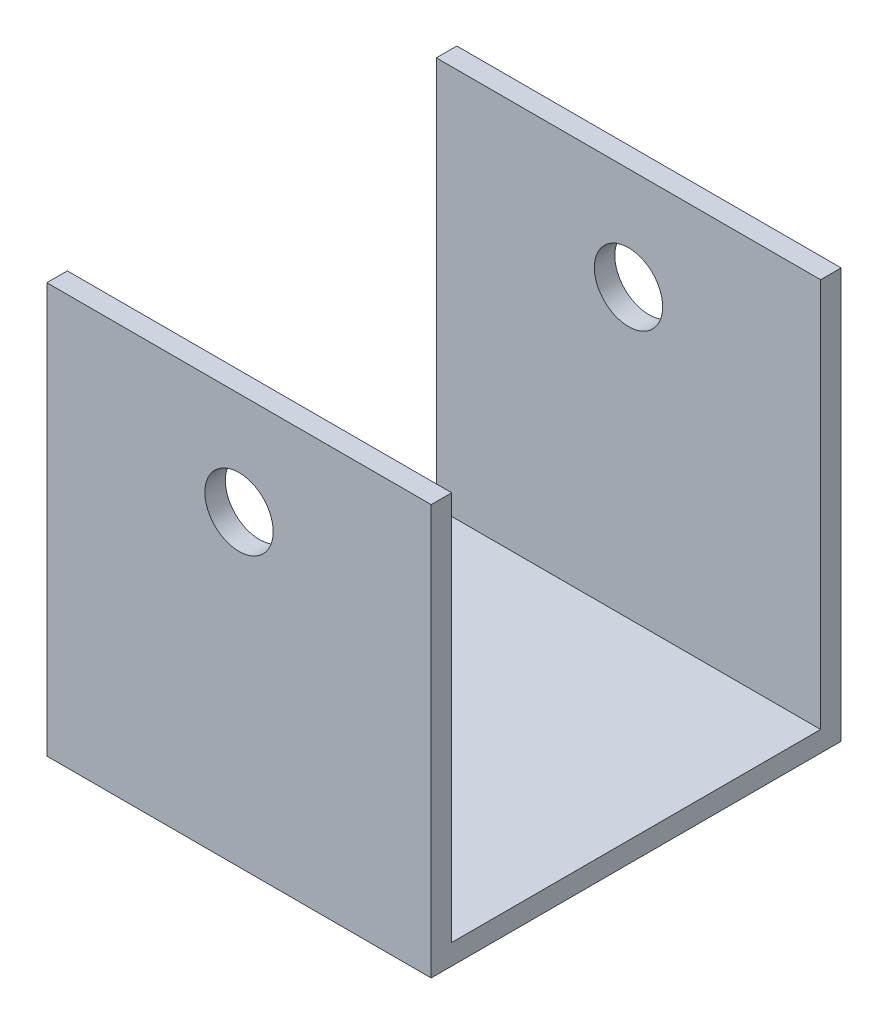
from build123d import *

# Parameters (mm, degrees)
SKETCH1_W               = 35.71875
SKETCH1_H               = 38.1
BOSS_EXTRUDE1_DEPTH     = 38.1
SKETCH2_W               = 34.29
SKETCH2_H               = 36.195
CUT_EXTRUDE1_DEPTH      = 65.645565212
CUT_EXTRUDE2_DEPTH      = 64.541459903
CUT_EXTRUDE2_DEPTH_BACK = 64.541459903
SKETCH3_R               = 3.175


with BuildPart() as part:
    # Sketch1 → Boss-Extrude1 (new body)
    with BuildSketch(Plane.XY):
        with Locations((-17.859375, 19.05)):
            Rectangle(SKETCH1_W, SKETCH1_H)
    extrude(amount=BOSS_EXTRUDE1_DEPTH)

    # Sketch2 → Cut-Extrude1 (cut, through all)
    with BuildSketch(Plane.ZY.offset(35.71875)):
        with Locations((19.05, 20.0025)):
            Rectangle(SKETCH2_W, SKETCH2_H)
    extrude(amount=-CUT_EXTRUDE1_DEPTH, mode=Mode.SUBTRACT)

    # Sketch3 → Cut-Extrude2 (cut, two sides: drawn at the far end of the back side and taken through both)
    with BuildSketch(Plane(origin=(0, 0, 36.195), x_dir=(-1, 0, 0), z_dir=(0, 0, -1)).offset(-CUT_EXTRUDE2_DEPTH_BACK)):
        with Locations(Location((17.859375, 28.575, 0), (0, 0, 90))):
            Circle(SKETCH3_R)
    extrude(amount=CUT_EXTRUDE2_DEPTH + CUT_EXTRUDE2_DEPTH_BACK, mode=Mode.SUBTRACT)


solid = part.part
